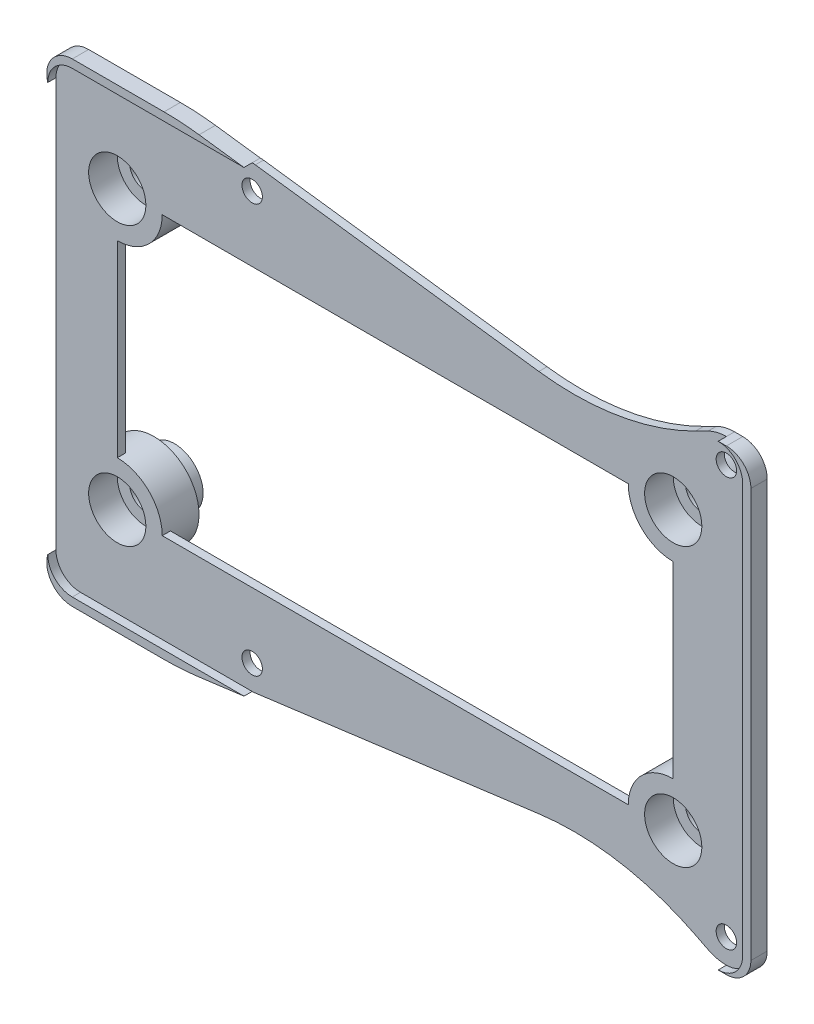
from build123d import *

# Parameters (mm, degrees)
SKIZZE1_R                         = 3.5
SKIZZE1_R_2                       = 2
AUFSATZ_LINEAR_AUSTRAGEN1_DEPTH   = 2.5
AUFSATZ_LINEAR_AUSTRAGEN1_2_DEPTH = 2.5
AUFSATZ_LINEAR_AUSTRAGEN1_3_DEPTH = 2.5
AUFSATZ_LINEAR_AUSTRAGEN1_4_DEPTH = 2.5
SKIZZE2_R                         = 5.5
SKIZZE2_R_2                       = 2
AUFSATZ_LINEAR_AUSTRAGEN3_DEPTH   = 1
SKIZZE3_R                         = 5.5
SKIZZE3_R_2                       = 3.5
AUFSATZ_LINEAR_AUSTRAGEN4_DEPTH   = 2.5
SKIZZE4_R                         = 3.5
SKIZZE4_R_2                       = 1.25
AUFSATZ_LINEAR_AUSTRAGEN7_DEPTH   = 1
SCHNITT_LINEAR_AUSTRAGEN1_DEPTH   = 1
AUFSATZ_LINEAR_AUSTRAGEN8_DEPTH   = 2


with BuildPart() as part:
    # Skizze1 → Aufsatz-Linear austragen1 (new body)
    with BuildSketch(Plane.XY):
        with Locations((0, 34)):
            Circle(SKIZZE1_R)
        with Locations((0, 34)):
            Circle(SKIZZE1_R_2, mode=Mode.SUBTRACT)
    extrude(amount=AUFSATZ_LINEAR_AUSTRAGEN1_DEPTH)



with BuildPart() as body_2:
    # Skizze1 → Aufsatz-Linear austragen1 2 (new body)
    with BuildSketch(Plane.XY):
        with Locations((68, 34)):
            Circle(SKIZZE1_R)
        with Locations((68, 34)):
            Circle(SKIZZE1_R_2, mode=Mode.SUBTRACT)
    extrude(amount=AUFSATZ_LINEAR_AUSTRAGEN1_2_DEPTH)


with BuildPart() as body_3:
    # Skizze1 → Aufsatz-Linear austragen1 3 (new body)
    with BuildSketch(Plane.XY):
        with Locations((68, 0)):
            Circle(SKIZZE1_R)
        with Locations((68, 0)):
            Circle(SKIZZE1_R_2, mode=Mode.SUBTRACT)
    extrude(amount=AUFSATZ_LINEAR_AUSTRAGEN1_3_DEPTH)


with BuildPart() as body_4:
    # Skizze1 → Aufsatz-Linear austragen1 4 (new body)
    with BuildSketch(Plane.XY):
        Circle(SKIZZE1_R)
        Circle(SKIZZE1_R_2, mode=Mode.SUBTRACT)
    extrude(amount=AUFSATZ_LINEAR_AUSTRAGEN1_4_DEPTH)


with BuildPart() as part_1:
    add(part.part)

    add(body_2.part)  # Aufsatz-Linear austragen3 merges body 2

    add(body_3.part)  # Aufsatz-Linear austragen3 merges body 3

    add(body_4.part)  # Aufsatz-Linear austragen3 merges body 4
    # Skizze2 → Aufsatz-Linear austragen3 (add)
    # profile 1 of 4: a face of its own
    with BuildSketch(Plane.XY.offset(2.5)):
        with Locations((0, 34)):
            Circle(SKIZZE2_R)
        with Locations((0, 34)):
            Circle(SKIZZE2_R_2, mode=Mode.SUBTRACT)
    # profile 2 of 4: a face of its own
    with BuildSketch(Plane.XY.offset(2.5)):
        with Locations((68, 34)):
            Circle(SKIZZE2_R)
        with Locations((68, 34)):
            Circle(SKIZZE2_R_2, mode=Mode.SUBTRACT)
    # profile 3 of 4: a face of its own
    with BuildSketch(Plane.XY.offset(2.5)):
        with Locations((68, 0)):
            Circle(SKIZZE2_R)
        with Locations((68, 0)):
            Circle(SKIZZE2_R_2, mode=Mode.SUBTRACT)
    # profile 4 of 4: a face of its own
    with BuildSketch(Plane.XY.offset(2.5)):
        Circle(SKIZZE2_R)
        Circle(SKIZZE2_R_2, mode=Mode.SUBTRACT)
    extrude(amount=AUFSATZ_LINEAR_AUSTRAGEN3_DEPTH)

    # Skizze3 → Aufsatz-Linear austragen4 (add)
    # profile 1 of 4: a face of its own
    with BuildSketch(Plane.XY.offset(3.5)):
        with Locations((0, 34)):
            Circle(SKIZZE3_R)
        with Locations((0, 34)):
            Circle(SKIZZE3_R_2, mode=Mode.SUBTRACT)
    # profile 2 of 4: a face of its own
    with BuildSketch(Plane.XY.offset(3.5)):
        with Locations((68, 34)):
            Circle(SKIZZE3_R)
        with Locations((68, 34)):
            Circle(SKIZZE3_R_2, mode=Mode.SUBTRACT)
    # profile 3 of 4: a face of its own
    with BuildSketch(Plane.XY.offset(3.5)):
        with Locations((68, 0)):
            Circle(SKIZZE3_R)
        with Locations((68, 0)):
            Circle(SKIZZE3_R_2, mode=Mode.SUBTRACT)
    # profile 4 of 4: a face of its own
    with BuildSketch(Plane.XY.offset(3.5)):
        Circle(SKIZZE3_R)
        Circle(SKIZZE3_R_2, mode=Mode.SUBTRACT)
    extrude(amount=AUFSATZ_LINEAR_AUSTRAGEN4_DEPTH)

    # Skizze4 → Aufsatz-Linear austragen7 (add)
    with BuildSketch(Plane.XY.offset(6)):
        with BuildLine():
            Line((-4.5, 45), (74.5, 45))
            ThreePointArc((74.5, 45), (76.621320344, 44.121320344), (77.5, 42))
            Line((77.5, 42), (77.5, -8))
            ThreePointArc((77.5, -8), (76.621320344, -10.121320344), (74.5, -11))
            Line((74.5, -11), (-4.5, -11))
            ThreePointArc((-4.5, -11), (-6.621320344, -10.121320344), (-7.5, -8))
            Line((-7.5, -8), (-7.5, 42))
            ThreePointArc((-7.5, 42), (-6.621320344, 44.121320344), (-4.5, 45))
        make_face()
        with Locations((0, 34)):
            Circle(SKIZZE4_R, mode=Mode.SUBTRACT)
        with Locations((68, 34)):
            Circle(SKIZZE4_R, mode=Mode.SUBTRACT)
        with Locations((68, 0)):
            Circle(SKIZZE4_R, mode=Mode.SUBTRACT)
        with Locations((74.5, 42)):
            Circle(SKIZZE4_R_2, mode=Mode.SUBTRACT)
        with Locations((74.5, -8)):
            Circle(SKIZZE4_R_2, mode=Mode.SUBTRACT)
        with Locations((16.5, 42)):
            Circle(SKIZZE4_R_2, mode=Mode.SUBTRACT)
        with Locations((16.5, -8)):
            Circle(SKIZZE4_R_2, mode=Mode.SUBTRACT)
        Circle(SKIZZE4_R, mode=Mode.SUBTRACT)
        with BuildLine():
            Line((5.5, 0), (62.5, 0))
            ThreePointArc((62.5, 0), (64.110912703, 3.889087297), (68, 5.5))
            Line((68, 5.5), (68, 28.5))
            ThreePointArc((68, 28.5), (64.110912703, 30.110912703), (62.5, 34))
            Line((62.5, 34), (5.5, 34))
            ThreePointArc((5.5, 34), (3.889087297, 30.110912703), (0, 28.5))
            Line((0, 28.5), (0, 5.5))
            ThreePointArc((0, 5.5), (3.889087297, 3.889087297), (5.5, 0))
        make_face(mode=Mode.SUBTRACT)
    extrude(amount=AUFSATZ_LINEAR_AUSTRAGEN7_DEPTH)

    # Skizze6 → Schnitt-Linear austragen1 (cut)
    with BuildSketch(Plane.XY.offset(7)):
        with BuildLine():
            Line((16.889911487, 44.974553585), (51.565115858, 40.429246163))
            ThreePointArc((51.565115858, 40.429246163), (61.389636667, 40.61691637), (70.723351618, 43.689080824))
            Line((70.723351618, 43.689080824), (72.267833458, 44.468613251))
            ThreePointArc((72.267833458, 44.468613251), (73.352727218, 44.865322658), (74.5, 45))
            Line((74.5, 45), (74.5, 49.663390108))
            Line((74.5, 49.663390108), (16.5, 49.663390108))
            Line((16.5, 49.663390108), (16.5, 45))
            ThreePointArc((16.5, 45), (16.695370473, 44.993631637), (16.889911487, 44.974553585))
        make_face()
        with BuildLine():
            Line((74.5, -11), (74.5, -15.663390108))
            Line((74.5, -15.663390108), (16.5, -15.663390108))
            Line((16.5, -15.663390108), (16.5, -11))
            ThreePointArc((16.5, -11), (16.695370473, -10.993631637), (16.889911487, -10.974553585))
            Line((16.889911487, -10.974553585), (51.565115858, -6.429246163))
            ThreePointArc((51.565115858, -6.429246163), (61.389636667, -6.61691637), (70.723351618, -9.689080824))
            Line((70.723351618, -9.689080824), (72.267833458, -10.468613251))
            ThreePointArc((72.267833458, -10.468613251), (73.352727218, -10.865322658), (74.5, -11))
        make_face()
    extrude(amount=-SCHNITT_LINEAR_AUSTRAGEN1_DEPTH, mode=Mode.SUBTRACT)

    # Skizze7 → Aufsatz-Linear austragen8 (add)
    with BuildSketch(Plane(origin=(0, 0, 6), x_dir=(-1, 0, 0), z_dir=(0, 0, -1))):
        with BuildLine():
            Line((-77.5, 42), (-77.5, -8))
            ThreePointArc((-77.5, -8), (-76.621320344, -10.121320344), (-74.5, -11))
            Line((-74.5, -11), (-75.5, -11))
            ThreePointArc((-75.5, -11), (-77.621320344, -10.121320344), (-78.5, -8))
            Line((-78.5, -8), (-78.5, 42))
            ThreePointArc((-78.5, 42), (-77.621320344, 44.121320344), (-75.5, 45))
            Line((-75.5, 45), (-74.5, 45))
            ThreePointArc((-74.5, 45), (-76.621320344, 44.121320344), (-77.5, 42))
        make_face()
        with BuildLine():
            Line((4.5, -11), (-16.5, -11))
            Line((-16.5, -11), (-11.006587527, -11.72008944))
            ThreePointArc((-11.006587527, -11.72008944), (-8.866636381, -11.929948007), (-6.717561173, -12))
            Line((-6.717561173, -12), (4.5, -12))
            ThreePointArc((4.5, -12), (7, -10.75), (7.5, -8))
            ThreePointArc((7.5, -8), (6.621320344, -10.121320344), (4.5, -11))
        make_face()
        with BuildLine():
            Line((-6.717561173, 46), (4.5, 46))
            ThreePointArc((4.5, 46), (7, 44.75), (7.5, 42))
            ThreePointArc((7.5, 42), (6.621320344, 44.121320344), (4.5, 45))
            Line((4.5, 45), (-16.5, 45))
            Line((-16.5, 45), (-11.006587527, 45.72008944))
            ThreePointArc((-11.006587527, 45.72008944), (-8.866636381, 45.929948007), (-6.717561173, 46))
        make_face()
    extrude(amount=-AUFSATZ_LINEAR_AUSTRAGEN8_DEPTH)


solid = part_1.part
